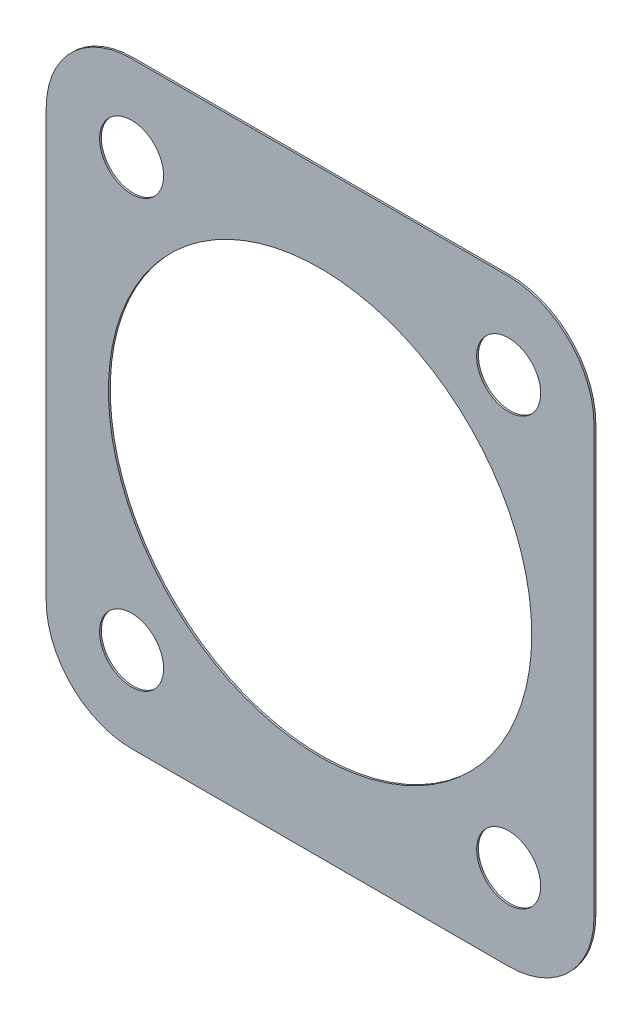
from build123d import *

# Parameters (mm, degrees)
SKETCH1_R           = 9
SKETCH1_R_2         = 59.5
BOSS_EXTRUDE1_DEPTH = 0.5


with BuildPart() as part:
    # Sketch1 → Boss-Extrude1 (new body)
    with BuildSketch(Plane.XY):
        with BuildLine():
            Line((-53, 84), (53, 84))
            ThreePointArc((53, 84), (69.970562748, 76.970562748), (77, 60))
            Line((77, 60), (77, -60))
            ThreePointArc((77, -60), (69.970562748, -76.970562748), (53, -84))
            Line((53, -84), (-53, -84))
            ThreePointArc((-53, -84), (-69.970562748, -76.970562748), (-77, -60))
            Line((-77, -60), (-77, 60))
            ThreePointArc((-77, 60), (-69.970562748, 76.970562748), (-53, 84))
        make_face()
        with Locations((53, 60)):
            Circle(SKETCH1_R, mode=Mode.SUBTRACT)
        with Locations(Location((-53, 60, 0), (0, 0, 180))):
            Circle(SKETCH1_R, mode=Mode.SUBTRACT)
        with Locations(Location((53, -60, 0), (0, 0, 180))):
            Circle(SKETCH1_R, mode=Mode.SUBTRACT)
        with Locations((-53, -60)):
            Circle(SKETCH1_R, mode=Mode.SUBTRACT)
        Circle(SKETCH1_R_2, mode=Mode.SUBTRACT)
    extrude(amount=BOSS_EXTRUDE1_DEPTH)


solid = part.part
